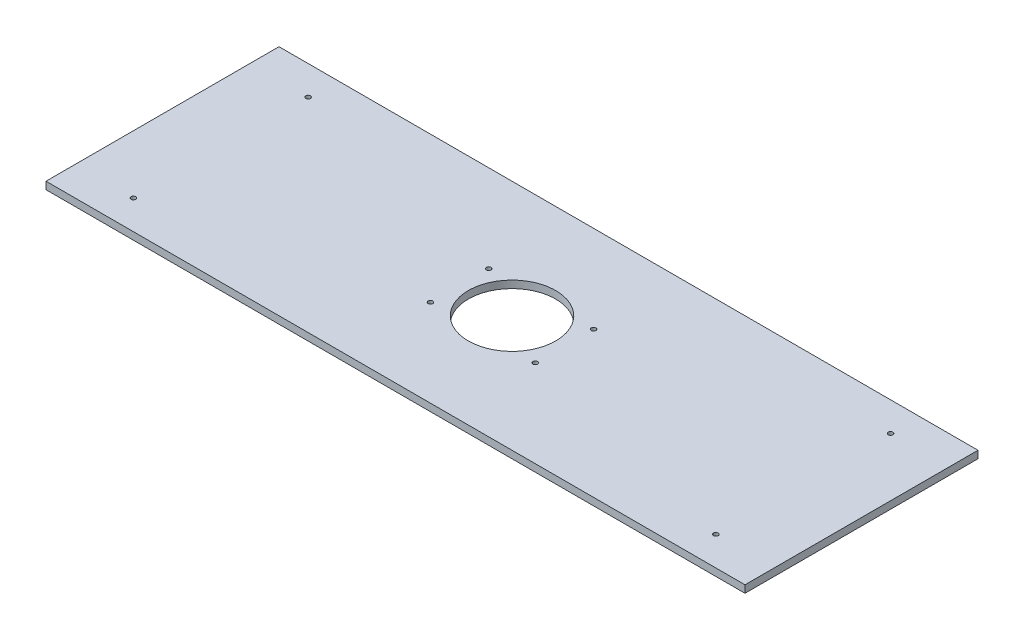
from build123d import *

# Parameters (mm, degrees)
SKETCH1_W           = 1200
SKETCH1_H           = 400
SKETCH1_R           = 4
SKETCH1_R_2         = 75
BOSS_EXTRUDE1_DEPTH = 12.7


with BuildPart() as part:
    # Sketch1 → Boss-Extrude1 (new body)
    with BuildSketch(Plane(origin=(0, 0, 0), x_dir=(1, 0, 0), z_dir=(0, 1, 0))):
        with Locations((600, 200)):
            Rectangle(SKETCH1_W, SKETCH1_H)
        with Locations(Location((510, 250, 0), (0, 0, 270))):
            Circle(SKETCH1_R, mode=Mode.SUBTRACT)
        with Locations(Location((690, 250, 0), (0, 0, 270))):
            Circle(SKETCH1_R, mode=Mode.SUBTRACT)
        with Locations(Location((510, 150, 0), (0, 0, 270))):
            Circle(SKETCH1_R, mode=Mode.SUBTRACT)
        with Locations(Location((690, 150, 0), (0, 0, 270))):
            Circle(SKETCH1_R, mode=Mode.SUBTRACT)
        with Locations(Location((600, 200, 0), (0, 0, 270))):
            Circle(SKETCH1_R_2, mode=Mode.SUBTRACT)
        with Locations(Location((100, 350, 0), (0, 0, 270))):
            Circle(SKETCH1_R, mode=Mode.SUBTRACT)
        with Locations(Location((100, 50, 0), (0, 0, 270))):
            Circle(SKETCH1_R, mode=Mode.SUBTRACT)
        with Locations(Location((1100, 350, 0), (0, 0, 270))):
            Circle(SKETCH1_R, mode=Mode.SUBTRACT)
        with Locations(Location((1100, 50, 0), (0, 0, 270))):
            Circle(SKETCH1_R, mode=Mode.SUBTRACT)
    extrude(amount=BOSS_EXTRUDE1_DEPTH)


solid = part.part
